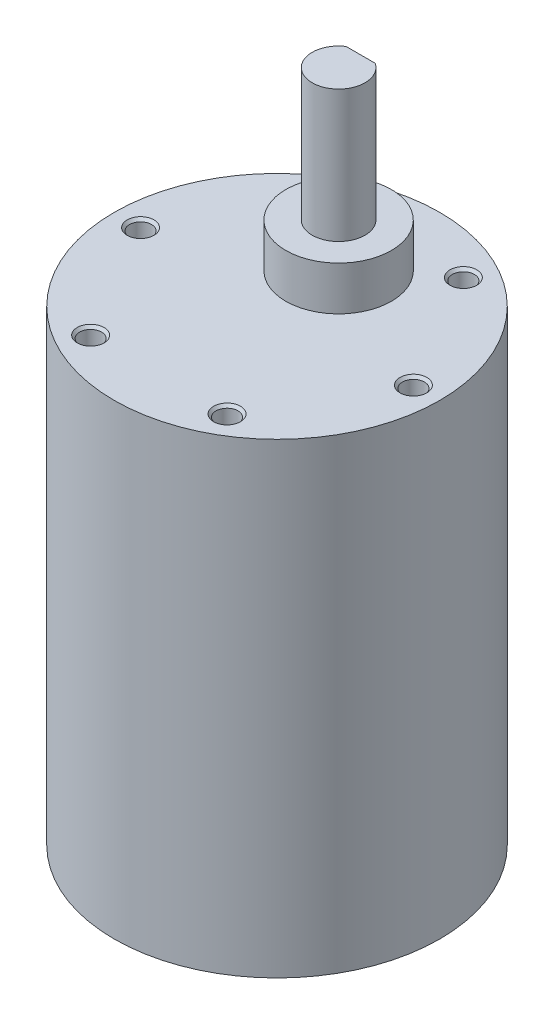
from build123d import *

# Parameters (mm, degrees)
SKETCH1_R           = 18.5
BOSS_EXTRUDE1_DEPTH = 53
SKETCH2_R           = 6
SKETCH2_R_2         = 3
BOSS_EXTRUDE2_DEPTH = 5
SKETCH2_3_R         = 3
BOSS_EXTRUDE3_DEPTH = 20
SKETCH4_W           = 9.457424045
SKETCH4_H           = 2.618978966
CUT_EXTRUDE1_DEPTH  = 14
CIRPATTERN1_COUNT   = 6


with BuildPart() as part:
    # Sketch1 → Boss-Extrude1 (new body)
    with BuildSketch(Plane(origin=(0, 0, 0), x_dir=(1, 0, 0), z_dir=(0, 1, 0))):
        Circle(SKETCH1_R)
    extrude(amount=BOSS_EXTRUDE1_DEPTH)

    # Sketch2 → Boss-Extrude2 (add)
    with BuildSketch(Plane(origin=(0, 53, 0), x_dir=(1, 0, 0), z_dir=(0, 1, 0))):
        with Locations((0, 7)):
            Circle(SKETCH2_R)
        with Locations((0, 7)):
            Circle(SKETCH2_R_2, mode=Mode.SUBTRACT)
    extrude(amount=BOSS_EXTRUDE2_DEPTH)

    # Sketch2<3> → Boss-Extrude3 (add)
    with BuildSketch(Plane(origin=(0, 53, 0), x_dir=(1, 0, 0), z_dir=(0, 1, 0))):
        with Locations((0, 7)):
            Circle(SKETCH2_3_R)
    extrude(amount=BOSS_EXTRUDE3_DEPTH)

    # Sketch4 → Cut-Extrude1 (cut)
    with BuildSketch(Plane(origin=(0, 73, 0), x_dir=(1, 0, 0), z_dir=(0, 1, 0))):
        with Locations((0.928983292, 10.809489483)):
            Rectangle(SKETCH4_W, SKETCH4_H)
    extrude(amount=-CUT_EXTRUDE1_DEPTH, mode=Mode.SUBTRACT)

    # Sketch7 → M3x0.5 Tapped Hole1 (revolve, cut)
    with BuildSketch(Plane(origin=(7.75, 53, -13.423393759), x_dir=(0, 0, 1), z_dir=(1, 0, 0))):
        Polygon((0, 0), (0, 8.751075774), (1.25, 8), (1.25, 0.316351312), (1.525, 0), align=None)
    m3x0_5_tapped_hole1 = revolve(axis=Axis((7.75, 59.35, -13.423393759), (0, -1, 0)), mode=Mode.SUBTRACT)

    # CirPattern1: M3x0.5 Tapped Hole1 ×6 about axis
    cirpattern1_axis = Axis((0, 53, 0), (0, 1, 0))
    for i in range(1, CIRPATTERN1_COUNT):
        add(m3x0_5_tapped_hole1.rotate(cirpattern1_axis, i * 360 / CIRPATTERN1_COUNT), mode=Mode.SUBTRACT)


solid = part.part
